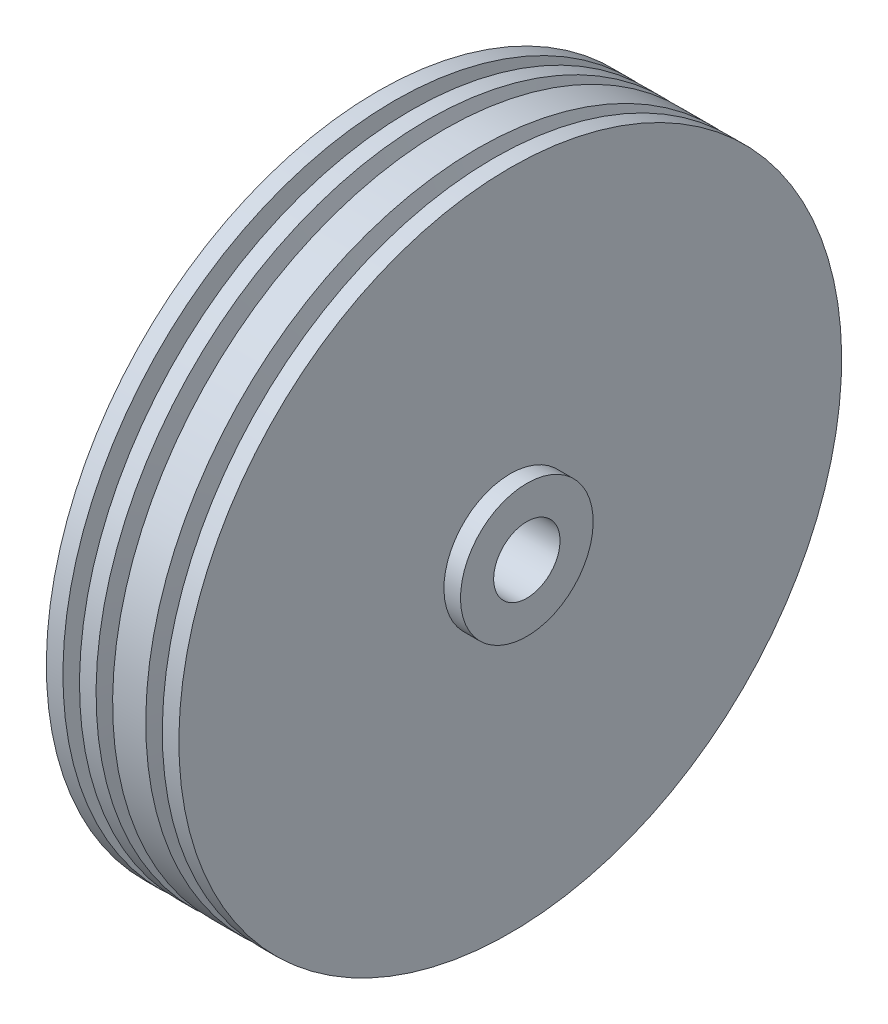
from build123d import *


with BuildPart() as part:
    # Croquis1 → Revolución2 (revolve)
    with BuildSketch(Plane.XY):
        Polygon((-15.224198293, 10.01641294), (-35.224198293, 10.01641294), (-35.224198293, 20.01641294), (-30.224198293, 20.01641294), (-30.224198293, 80.01641294), (-50.224198293, 80.01641294), (-60.224198293, 80.01641294), (-60.224198293, 100.01641294), (-55.224198293, 100.01641294), (-55.224198293, 90.01641294), (-50.224198293, 90.01641294), (-50.224198293, 100.01641294), (-45.224198293, 100.01641294), (-42.724198293, 90.01641294), (-40.224198293, 100.01641294), (-30.224198293, 100.01641294), (-27.724198293, 90.01641294), (-25.224198293, 100.01641294), (-20.224198293, 100.01641294), (-20.224198293, 80.01641294), (-20.224198293, 20.01641294), (-15.224198293, 20.01641294), align=None)
    revolve(axis=Axis((68.905582562, 0, 0), (-1, 0, 0)))


solid = part.part
